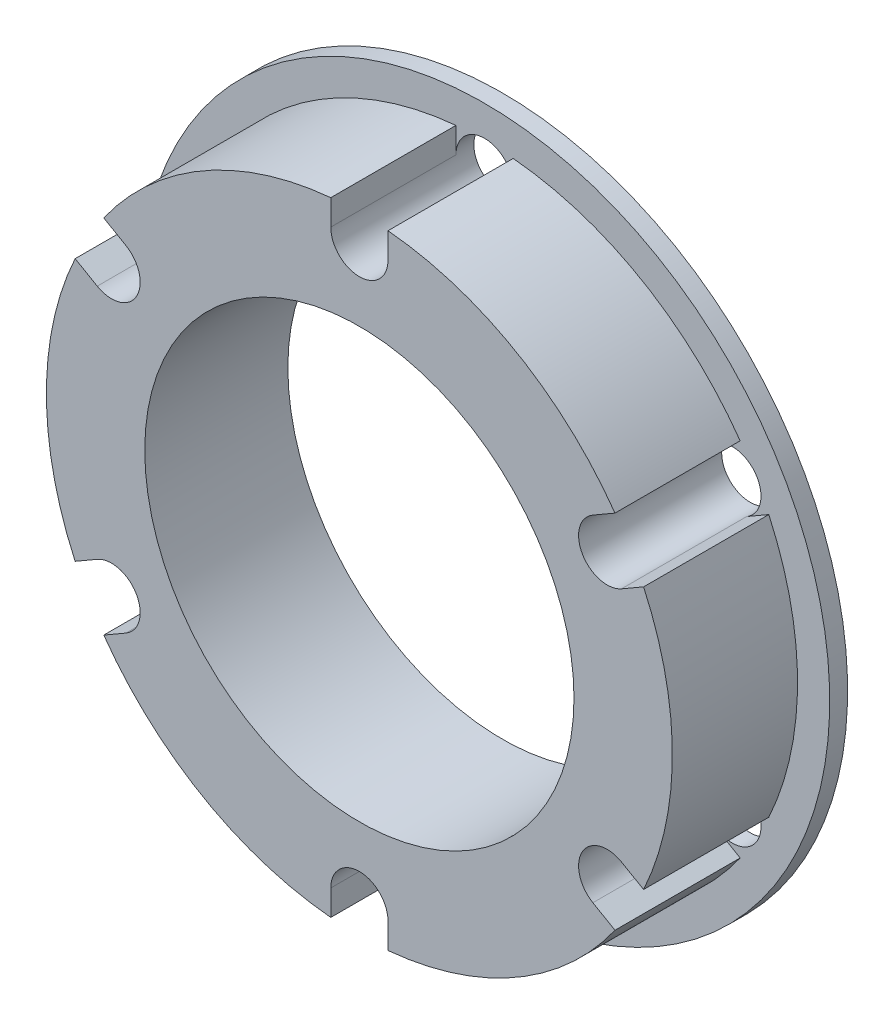
from build123d import *

# Parameters (mm, degrees)
CORTAR_EXTRUIR1_DEPTH = 7
CORTAR_EXTRUIR2_REACH = 30.443
CROQUIS5_R            = 1.6


with BuildPart() as part:
    # Croquis1 → Revolución1 (revolve)
    with BuildSketch(Plane(origin=(0, 0, 0), x_dir=(1, 0, 0), z_dir=(0, 1, 0))):
        Polygon((-12, 4.5), (-19.3, 4.5), (-19.3, 3.5), (-17.5, 3.5), (-17.5, -3.5), (-12, -3.5), align=None)
    revolve(axis=Axis((0, 0, -14.909787419), (0, 0, 1)))

    # Croquis2 → Cortar-Extruir1 (cut)
    with BuildSketch(Plane.XY.offset(3.5)):
        with BuildLine():
            Line((1.6, 16), (1.6, 17.426703647))
            ThreePointArc((1.6, 17.426703647), (0, 17.5), (-1.6, 17.426703647))
            Line((-1.6, 17.426703647), (-1.6, 16))
            ThreePointArc((-1.6, 16), (0, 14.4), (1.6, 16))
        make_face()
        with BuildLine():
            Line((14.656406461, 6.614359354), (15.891968063, 7.327711177))
            ThreePointArc((15.891968063, 7.327711177), (15.155444566, 8.75), (14.291968063, 10.09899247))
            Line((14.291968063, 10.09899247), (13.056406461, 9.385640646))
            ThreePointArc((13.056406461, 9.385640646), (12.470765814, 7.2), (14.656406461, 6.614359354))
        make_face()
        with BuildLine():
            Line((13.056406461, -9.385640646), (14.291968063, -10.09899247))
            ThreePointArc((14.291968063, -10.09899247), (15.155444566, -8.75), (15.891968063, -7.327711177))
            Line((15.891968063, -7.327711177), (14.656406461, -6.614359354))
            ThreePointArc((14.656406461, -6.614359354), (12.470765814, -7.2), (13.056406461, -9.385640646))
        make_face()
        with BuildLine():
            Line((-1.6, -16), (-1.6, -17.426703647))
            ThreePointArc((-1.6, -17.426703647), (0, -17.5), (1.6, -17.426703647))
            Line((1.6, -17.426703647), (1.6, -16))
            ThreePointArc((1.6, -16), (0, -14.4), (-1.6, -16))
        make_face()
        with BuildLine():
            Line((-14.656406461, -6.614359354), (-15.891968063, -7.327711177))
            ThreePointArc((-15.891968063, -7.327711177), (-15.155444566, -8.75), (-14.291968063, -10.09899247))
            Line((-14.291968063, -10.09899247), (-13.056406461, -9.385640646))
            ThreePointArc((-13.056406461, -9.385640646), (-12.470765814, -7.2), (-14.656406461, -6.614359354))
        make_face()
        with BuildLine():
            Line((-13.056406461, 9.385640646), (-14.291968063, 10.09899247))
            ThreePointArc((-14.291968063, 10.09899247), (-15.155444566, 8.75), (-15.891968063, 7.327711177))
            Line((-15.891968063, 7.327711177), (-14.656406461, 6.614359354))
            ThreePointArc((-14.656406461, 6.614359354), (-12.470765814, 7.2), (-13.056406461, 9.385640646))
        make_face()
    extrude(amount=-CORTAR_EXTRUIR1_DEPTH, mode=Mode.SUBTRACT)

    # Croquis5 → Cortar-Extruir2 (cut, up to next)
    with BuildSketch(Plane(origin=(0, 0, -4.5), x_dir=(-1, 0, 0), z_dir=(0, 0, -1)), mode=Mode.PRIVATE) as cortar_extruir2_sk1:
        with Locations((0, 16)):
            Circle(CROQUIS5_R)
    cortar_extruir2_tool1 = extrude(cortar_extruir2_sk1.sketch, amount=-CORTAR_EXTRUIR2_REACH, mode=Mode.PRIVATE) & part.part
    # Croquis5 → Cortar-Extruir2 (cut, up to next)
    with BuildSketch(Plane(origin=(0, 0, -4.5), x_dir=(-1, 0, 0), z_dir=(0, 0, -1)), mode=Mode.PRIVATE) as cortar_extruir2_sk2:
        with Locations(Location((13.856406461, 8, 0), (0, 0, 120))):
            Circle(CROQUIS5_R)
    cortar_extruir2_tool2 = extrude(cortar_extruir2_sk2.sketch, amount=-CORTAR_EXTRUIR2_REACH, mode=Mode.PRIVATE) & part.part
    # Croquis5 → Cortar-Extruir2 (cut, up to next)
    with BuildSketch(Plane(origin=(0, 0, -4.5), x_dir=(-1, 0, 0), z_dir=(0, 0, -1)), mode=Mode.PRIVATE) as cortar_extruir2_sk3:
        with Locations(Location((13.856406461, -8, 0), (0, 0, 240))):
            Circle(CROQUIS5_R)
    cortar_extruir2_tool3 = extrude(cortar_extruir2_sk3.sketch, amount=-CORTAR_EXTRUIR2_REACH, mode=Mode.PRIVATE) & part.part
    # Croquis5 → Cortar-Extruir2 (cut, up to next)
    with BuildSketch(Plane(origin=(0, 0, -4.5), x_dir=(-1, 0, 0), z_dir=(0, 0, -1)), mode=Mode.PRIVATE) as cortar_extruir2_sk4:
        with Locations((0, -16)):
            Circle(CROQUIS5_R)
    cortar_extruir2_tool4 = extrude(cortar_extruir2_sk4.sketch, amount=-CORTAR_EXTRUIR2_REACH, mode=Mode.PRIVATE) & part.part
    # Croquis5 → Cortar-Extruir2 (cut, up to next)
    with BuildSketch(Plane(origin=(0, 0, -4.5), x_dir=(-1, 0, 0), z_dir=(0, 0, -1)), mode=Mode.PRIVATE) as cortar_extruir2_sk5:
        with Locations(Location((-13.856406461, -8, 0), (0, 0, 120))):
            Circle(CROQUIS5_R)
    cortar_extruir2_tool5 = extrude(cortar_extruir2_sk5.sketch, amount=-CORTAR_EXTRUIR2_REACH, mode=Mode.PRIVATE) & part.part
    # Croquis5 → Cortar-Extruir2 (cut, up to next)
    with BuildSketch(Plane(origin=(0, 0, -4.5), x_dir=(-1, 0, 0), z_dir=(0, 0, -1)), mode=Mode.PRIVATE) as cortar_extruir2_sk6:
        with Locations(Location((-13.856406461, 8, 0), (0, 0, 240))):
            Circle(CROQUIS5_R)
    cortar_extruir2_tool6 = extrude(cortar_extruir2_sk6.sketch, amount=-CORTAR_EXTRUIR2_REACH, mode=Mode.PRIVATE) & part.part
    add(cortar_extruir2_tool1.solids().sort_by_distance((0, 16, -4.5))[0], mode=Mode.SUBTRACT)
    add(cortar_extruir2_tool2.solids().sort_by_distance((-13.856406, 8, -4.5))[0], mode=Mode.SUBTRACT)
    add(cortar_extruir2_tool3.solids().sort_by_distance((-13.856406, -8, -4.5))[0], mode=Mode.SUBTRACT)
    add(cortar_extruir2_tool4.solids().sort_by_distance((0, -16, -4.5))[0], mode=Mode.SUBTRACT)
    add(cortar_extruir2_tool5.solids().sort_by_distance((13.856406, -8, -4.5))[0], mode=Mode.SUBTRACT)
    add(cortar_extruir2_tool6.solids().sort_by_distance((13.856406, 8, -4.5))[0], mode=Mode.SUBTRACT)


solid = part.part
